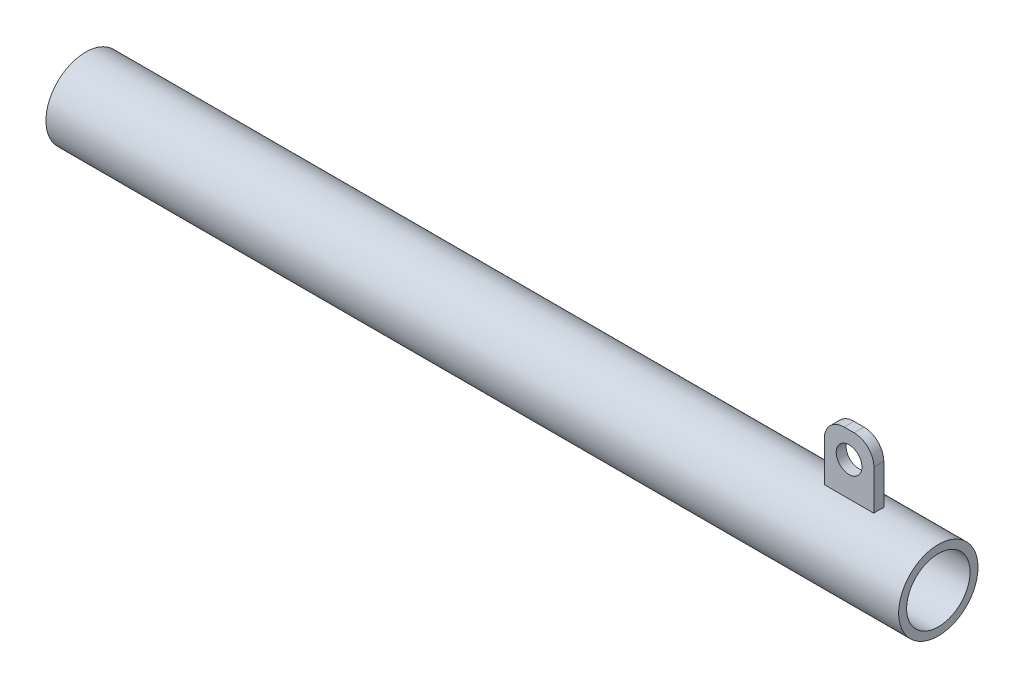
from build123d import *

# Parameters (mm, degrees)
SKETCH1_R                = 20
SKETCH1_R_2              = 16
BOSS_EXTRUDE1_DEPTH      = 430
BOSS_EXTRUDE2_REACH      = 438.119
BOSS_EXTRUDE2_END_RADIUS = 20
SKETCH2_W                = 25
SKETCH2_H                = 5
FILLET1_R                = 10
SKETCH3_R                = 6.5
CUT_EXTRUDE1_DEPTH       = 10


with BuildPart() as part:
    # Sketch1 → Boss-Extrude1 (new body)
    with BuildSketch(Plane(origin=(0, 0, 0), x_dir=(0, 0, -1), z_dir=(1, 0, 0))):
        Circle(SKETCH1_R)
        Circle(SKETCH1_R_2, mode=Mode.SUBTRACT)
    extrude(amount=-BOSS_EXTRUDE1_DEPTH)

    # Boss-Extrude2: up to this cylinder (the profile starts outside it)
    boss_extrude2_end = Plane(origin=(-42.5, 0, 0), z_dir=(1, 0, 0)) * Cylinder(BOSS_EXTRUDE2_END_RADIUS, 917.238, mode=Mode.PRIVATE)
    # Sketch2 → Boss-Extrude2 (add, up to the surface)
    with BuildSketch(Plane(origin=(0, 50, 0), x_dir=(1, 0, 0), z_dir=(0, 1, 0)), mode=Mode.PRIVATE) as boss_extrude2_sk1:
        with Locations((-42.5, 0)):
            Rectangle(SKETCH2_W, SKETCH2_H)
    boss_extrude2_tool1 = extrude(boss_extrude2_sk1.sketch, amount=-BOSS_EXTRUDE2_REACH, mode=Mode.PRIVATE) - boss_extrude2_end
    add(boss_extrude2_tool1.solids().sort_by_distance((-42.5, 50, 0))[0])

    # Fillet1
    fillet1_edges = [part.edges().sort_by_distance(p)[0] for p in [
        (-30, 50, 0),
        (-55, 50, 0),
    ]]
    fillet(fillet1_edges, radius=FILLET1_R)

    # Sketch3 → Cut-Extrude1 (cut)
    with BuildSketch(Plane.XY.offset(2.5)):
        with Locations((-42.5, 37)):
            Circle(SKETCH3_R)
    extrude(amount=-CUT_EXTRUDE1_DEPTH, mode=Mode.SUBTRACT)


solid = part.part
